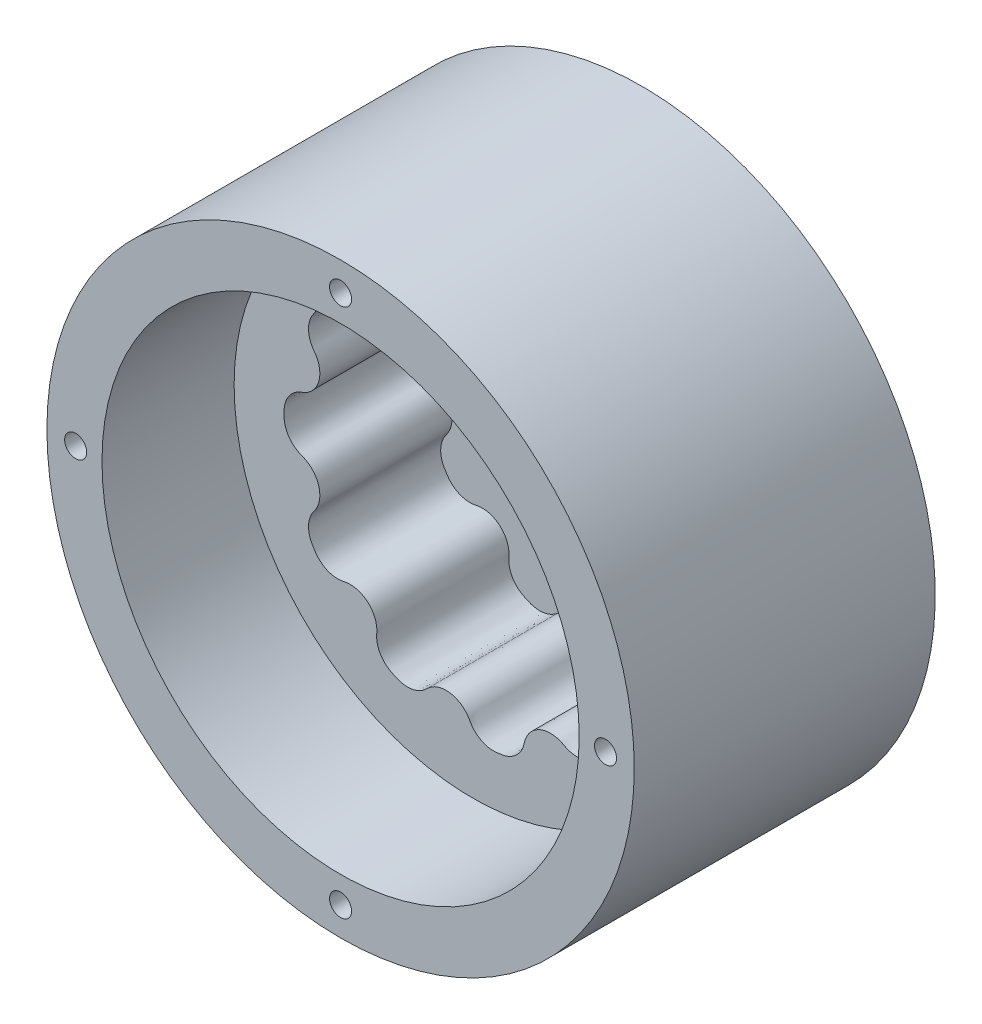
from build123d import *

# Parameters (mm, degrees)
SKETCH1_R           = 35.5
BOSS_EXTRUDE1_DEPTH = 18
BOSS_EXTRUDE4_START = 18
SKETCH2_R           = 40
SKETCH2_R_2         = 32.5
BOSS_EXTRUDE4_DEPTH = 36
SKETCH5_R           = 40
SKETCH5_R_2         = 14
BOSS_EXTRUDE5_DEPTH = 5
SKETCH6_R           = 1.5
CUT_EXTRUDE1_DEPTH  = 8


with BuildPart() as part:
    # Sketch1 → Boss-Extrude1 (new body)
    with BuildSketch(Plane.XY):
        Circle(SKETCH1_R)
        with BuildLine():
            add(Edge.make_bspline(
                [(3.837275289, 25.411912922), (3.717481283, 25.430002177), (3.597562363, 25.447243915), (3.477524524, 25.463637273), (3.43744086, 25.469111429), (3.357247678, 25.479870448), (3.236836498, 25.495587087), (3.156280382, 25.503281028), (3.115949416, 25.506455885), (1.732893374, 25.615330169), (0.492503636, 24.993935832), (-0.248417397, 23.821019107), (-0.284472247, 23.763942396), (-0.353407368, 23.647783622), (-0.446251784, 23.467496593), (-0.515240226, 23.351369479), (-0.551321274, 23.294309326), (-1.839165713, 21.257655651), (-4.2243071, 20.914724091), (-6.033776437, 22.506051276), (-6.084471653, 22.550634885), (-6.183382367, 22.642621746), (-6.323258657, 22.789448588), (-6.42212713, 22.881480847), (-6.472801872, 22.926087726), (-7.514159226, 23.842751505), (-8.87937148, 24.089516833), (-10.175730603, 23.595400807), (-10.213533421, 23.580992008), (-10.288658814, 23.550914445), (-10.399764607, 23.501910691), (-10.473678235, 23.468994458), (-10.510595982, 23.452449171), (-10.621152902, 23.402901291), (-10.731356705, 23.352572901), (-10.841201879, 23.301466516), (-10.877881956, 23.284400804), (-10.951161518, 23.25009616), (-11.060954905, 23.198218638), (-11.13288268, 23.161139269), (-11.168527706, 23.142005562), (-12.390890369, 22.48585989), (-13.098421476, 21.292504387), (-13.087597256, 19.905211894), (-13.087070525, 19.837703186), (-13.082262265, 19.702715067), (-13.062897432, 19.500852487), (-13.058151144, 19.365862174), (-13.057655406, 19.298353231), (-13.039960982, 16.888749861), (-14.861066801, 15.310752686), (-17.243625704, 15.67118932), (-17.310376952, 15.681287537), (-17.443317791, 15.705196639), (-17.640369798, 15.753092407), (-17.773299646, 15.777062538), (-17.840046252, 15.787191398), (-19.21167766, 15.99533775), (-20.493578699, 15.464840484), (-21.317006099, 14.348298976), (-21.341017869, 14.315739776), (-21.387956213, 14.249821067), (-21.454930925, 14.148528159), (-21.499315166, 14.080876537), (-21.521427293, 14.046998515), (-21.587646087, 13.945544602), (-21.653145843, 13.843624993), (-21.717923286, 13.741244781), (-21.73955411, 13.707057444), (-21.782654309, 13.638580618), (-21.846971279, 13.535579683), (-21.887434153, 13.465499442), (-21.907076194, 13.430131987), (-22.580653969, 12.217287973), (-22.530690319, 10.830853244), (-21.771557458, 9.669640549), (-21.734616381, 9.613133382), (-21.657591328, 9.502173691), (-21.532165443, 9.342825502), (-21.455191338, 9.231830461), (-21.418276207, 9.175306341), (-20.100660775, 7.157785321), (-20.779542796, 4.845725484), (-22.978745647, 3.860835483), (-23.040359878, 3.833242194), (-23.165123065, 3.781482567), (-23.356788169, 3.715240693), (-23.481575105, 3.663538348), (-23.543201998, 3.635973348), (-24.809624179, 3.069517276), (-25.601219482, 1.930186552), (-25.690282778, 0.545713601), (-25.692879932, 0.505341316), (-25.696728634, 0.424510184), (-25.698308266, 0.303087904), (-25.699071438, 0.222179806), (-25.699357502, 0.181725081), (-25.70021417, 0.060576037), (-25.70021417, -0.060576037), (-25.699357502, -0.181725081), (-25.699071438, -0.222179806), (-25.698308266, -0.303087904), (-25.696728634, -0.424510184), (-25.692879932, -0.505341316), (-25.690282778, -0.545713601), (-25.601219482, -1.930186552), (-24.809624179, -3.069517276), (-23.543201998, -3.635973348), (-23.481575105, -3.663538348), (-23.356788169, -3.715240693), (-23.165123065, -3.781482567), (-23.040359878, -3.833242194), (-22.978745647, -3.860835483), (-20.779542796, -4.845725484), (-20.100660775, -7.157785321), (-21.418276207, -9.175306341), (-21.455191338, -9.231830461), (-21.532165443, -9.342825502), (-21.657591328, -9.502173691), (-21.734616381, -9.613133382), (-21.771557458, -9.669640549), (-22.530690319, -10.830853244), (-22.580653969, -12.217287973), (-21.907076194, -13.430131987), (-21.887434153, -13.465499442), (-21.846971279, -13.535579683), (-21.782654309, -13.638580618), (-21.73955411, -13.707057444), (-21.717923286, -13.741244781), (-21.653145843, -13.843624993), (-21.587646087, -13.945544602), (-21.521427293, -14.046998515), (-21.499315166, -14.080876537), (-21.454930925, -14.148528159), (-21.387956213, -14.249821067), (-21.341017869, -14.315739776), (-21.317006099, -14.348298976), (-20.493578699, -15.464840484), (-19.21167766, -15.99533775), (-17.840046252, -15.787191398), (-17.773299646, -15.777062538), (-17.640369798, -15.753092407), (-17.443317791, -15.705196639), (-17.310376952, -15.681287537), (-17.243625704, -15.67118932), (-14.861066801, -15.310752686), (-13.039960982, -16.888749861), (-13.057655406, -19.298353231), (-13.058151144, -19.365862174), (-13.062897432, -19.500852487), (-13.082262265, -19.702715067), (-13.087070525, -19.837703186), (-13.087597256, -19.905211894), (-13.098421476, -21.292504387), (-12.390890369, -22.48585989), (-11.168527706, -23.142005562), (-11.13288268, -23.161139269), (-11.060954905, -23.198218638), (-10.951161518, -23.25009616), (-10.877881956, -23.284400804), (-10.841201879, -23.301466516), (-10.731356705, -23.352572901), (-10.621152902, -23.402901291), (-10.510595982, -23.452449171), (-10.473678235, -23.468994458), (-10.399764607, -23.501910691), (-10.288658814, -23.550914445), (-10.213533421, -23.580992008), (-10.175730603, -23.595400807), (-8.87937148, -24.089516833), (-7.514159226, -23.842751505), (-6.472801872, -22.926087726), (-6.42212713, -22.881480847), (-6.323258657, -22.789448588), (-6.183382367, -22.642621746), (-6.084471653, -22.550634885), (-6.033776437, -22.506051276), (-4.2243071, -20.914724091), (-1.839165713, -21.257655651), (-0.551321274, -23.294309326), (-0.515240226, -23.351369479), (-0.446251784, -23.467496593), (-0.353407368, -23.647783622), (-0.284472247, -23.763942396), (-0.248417397, -23.821019107), (0.492503636, -24.993935832), (1.732893374, -25.615330169), (3.115949416, -25.506455885), (3.156280382, -25.503281028), (3.236836498, -25.495587087), (3.357247678, -25.479870448), (3.43744086, -25.469111429), (3.477524524, -25.463637273), (3.597562363, -25.447243915), (3.717481283, -25.430002177), (3.837275289, -25.411912922), (3.877277532, -25.405872463), (3.957253491, -25.393602636), (4.077215062, -25.37475889), (4.156675722, -25.359445892), (4.196267462, -25.351129599), (5.553973446, -25.065941795), (6.569051669, -24.120260123), (6.949511367, -22.786113189), (6.968025374, -22.721190661), (7.00144243, -22.590315865), (7.039733269, -22.391174434), (7.073210405, -22.260314993), (7.091754215, -22.195400971), (7.753640258, -19.878418374), (9.945551675, -18.87740597), (12.130053466, -19.8944868), (12.191255824, -19.922981967), (12.312075652, -19.983376345), (12.487651871, -20.084847964), (12.60844396, -20.145297802), (12.669633229, -20.173821064), (13.927062324, -20.75996925), (15.306495715, -20.612114109), (16.411134614, -19.772786684), (16.443346725, -19.748311257), (16.506955183, -19.698286778), (16.599754458, -19.619965902), (16.66140049, -19.567559132), (16.692161462, -19.541283113), (16.7842808, -19.462594787), (16.875841428, -19.383257052), (16.966838768, -19.303273873), (16.997225078, -19.27656547), (17.057871567, -19.223005167), (17.148601964, -19.142296677), (17.207169693, -19.086454887), (17.235980257, -19.058053866), (18.223971045, -18.084107345), (18.566635074, -16.739756577), (18.16540385, -15.411708713), (18.145879055, -15.347082979), (18.103235015, -15.21891747), (18.027783333, -15.030687447), (17.985198137, -14.902502374), (17.965703012, -14.837867684), (17.269861618, -12.530855277), (18.572626677, -10.503713276), (20.960221938, -10.178305282), (21.027114288, -10.16918845), (21.161406062, -10.154675303), (21.363969875, -10.14511499), (21.498268297, -10.130663497), (21.565164825, -10.121577375), (22.939877128, -9.934859113), (24.020393817, -9.064697457), (24.495900528, -7.761397418), (24.509766665, -7.723392198), (24.53623223, -7.646919599), (24.571956485, -7.530860809), (24.595483189, -7.453445068), (24.607155077, -7.414709637), (24.642108675, -7.298709331), (24.676241158, -7.182464768), (24.709550821, -7.065981759), (24.720673758, -7.027085142), (24.742735946, -6.94923938), (24.775428909, -6.832290522), (24.794508867, -6.753649314), (24.803391104, -6.714180688), (25.107986602, -5.360696589), (24.669443029, -4.044498595), (23.613908961, -3.144195615), (23.562544349, -3.100384889), (23.457378394, -3.015620311), (23.292139566, -2.898063398), (23.187012537, -2.813250548), (23.135668043, -2.769416246), (21.303023938, -1.204834168), (21.303023938, 1.204834168), (23.135668043, 2.769416246), (23.187012537, 2.813250548), (23.292139566, 2.898063398), (23.457378394, 3.015620311), (23.562544349, 3.100384889), (23.613908961, 3.144195615), (24.669443029, 4.044498595), (25.107986602, 5.360696589), (24.803391104, 6.714180688), (24.794508867, 6.753649314), (24.775428909, 6.832290522), (24.742735946, 6.94923938), (24.720673758, 7.027085142), (24.709550821, 7.065981759), (24.676241158, 7.182464768), (24.642108675, 7.298709331), (24.607155077, 7.414709637), (24.595483189, 7.453445068), (24.571956485, 7.530860809), (24.53623223, 7.646919599), (24.509766665, 7.723392198), (24.495900528, 7.761397418), (24.020393817, 9.064697457), (22.939877128, 9.934859113), (21.565164825, 10.121577375), (21.498268297, 10.130663497), (21.363969875, 10.14511499), (21.161406062, 10.154675303), (21.027114288, 10.16918845), (20.960221938, 10.178305282), (18.572626677, 10.503713276), (17.269861618, 12.530855277), (17.965703012, 14.837867684), (17.985198137, 14.902502374), (18.027783333, 15.030687447), (18.103235015, 15.21891747), (18.145879055, 15.347082979), (18.16540385, 15.411708713), (18.566635074, 16.739756577), (18.223971045, 18.084107345), (17.235980257, 19.058053866), (17.207169693, 19.086454887), (17.148601964, 19.142296677), (17.057871567, 19.223005167), (16.997225078, 19.27656547), (16.966838768, 19.303273873), (16.875841428, 19.383257052), (16.7842808, 19.462594787), (16.692161462, 19.541283113), (16.66140049, 19.567559132), (16.599754458, 19.619965902), (16.506955183, 19.698286778), (16.443346725, 19.748311257), (16.411134614, 19.772786684), (15.306495715, 20.612114109), (13.927062324, 20.75996925), (12.669633229, 20.173821064), (12.60844396, 20.145297802), (12.487651871, 20.084847964), (12.312075652, 19.983376345), (12.191255824, 19.922981967), (12.130053466, 19.8944868), (9.945551675, 18.87740597), (7.753640258, 19.878418374), (7.091754215, 22.195400971), (7.073210405, 22.260314993), (7.039733269, 22.391174434), (7.00144243, 22.590315865), (6.968025374, 22.721190661), (6.949511367, 22.786113189), (6.569051669, 24.120260123), (5.553973446, 25.065941795), (4.196267462, 25.351129599), (4.156675722, 25.359445892), (4.077215062, 25.37475889), (3.957253491, 25.393602636), (3.877277532, 25.405872463), (3.837275289, 25.411912922)],
                knots=[0, 0, 0, 0, 0.002149486, 0.002149486, 0.002149486, 0.002867266, 0.003585046, 0.004302825, 0.004302825, 0.004302825, 0.026557243, 0.026557243, 0.026557243, 0.027755042, 0.028952842, 0.030150641, 0.030150641, 0.030150641, 0.062907936, 0.062907936, 0.062907936, 0.064105736, 0.065303535, 0.066501334, 0.066501334, 0.066501334, 0.088755752, 0.088755752, 0.088755752, 0.089473532, 0.090191311, 0.090909091, 0.090909091, 0.090909091, 0.093058577, 0.093058577, 0.093058577, 0.093776357, 0.094494137, 0.095211916, 0.095211916, 0.095211916, 0.117466334, 0.117466334, 0.117466334, 0.118664133, 0.119861933, 0.121059732, 0.121059732, 0.121059732, 0.153817027, 0.153817027, 0.153817027, 0.155014826, 0.156212626, 0.157410425, 0.157410425, 0.157410425, 0.179664843, 0.179664843, 0.179664843, 0.180382622, 0.181100402, 0.181818182, 0.181818182, 0.181818182, 0.183967668, 0.183967668, 0.183967668, 0.184685448, 0.185403227, 0.186121007, 0.186121007, 0.186121007, 0.208375425, 0.208375425, 0.208375425, 0.209573224, 0.210771023, 0.211968823, 0.211968823, 0.211968823, 0.244726118, 0.244726118, 0.244726118, 0.245923917, 0.247121717, 0.248319516, 0.248319516, 0.248319516, 0.270573934, 0.270573934, 0.270573934, 0.271291713, 0.272009493, 0.272727273, 0.272727273, 0.272727273, 0.274876759, 0.274876759, 0.274876759, 0.275594539, 0.276312318, 0.277030098, 0.277030098, 0.277030098, 0.299284516, 0.299284516, 0.299284516, 0.300482315, 0.301680114, 0.302877914, 0.302877914, 0.302877914, 0.335635209, 0.335635209, 0.335635209, 0.336833008, 0.338030808, 0.339228607, 0.339228607, 0.339228607, 0.361483025, 0.361483025, 0.361483025, 0.362200804, 0.362918584, 0.363636364, 0.363636364, 0.363636364, 0.36578585, 0.36578585, 0.36578585, 0.36650363, 0.367221409, 0.367939189, 0.367939189, 0.367939189, 0.390193607, 0.390193607, 0.390193607, 0.391391406, 0.392589205, 0.393787005, 0.393787005, 0.393787005, 0.4265443, 0.4265443, 0.4265443, 0.427742099, 0.428939899, 0.430137698, 0.430137698, 0.430137698, 0.452392115, 0.452392115, 0.452392115, 0.453109895, 0.453827675, 0.454545455, 0.454545455, 0.454545455, 0.456694941, 0.456694941, 0.456694941, 0.45741272, 0.4581305, 0.45884828, 0.45884828, 0.45884828, 0.481102697, 0.481102697, 0.481102697, 0.482300497, 0.483498296, 0.484696096, 0.484696096, 0.484696096, 0.517453391, 0.517453391, 0.517453391, 0.51865119, 0.519848989, 0.521046789, 0.521046789, 0.521046789, 0.543301206, 0.543301206, 0.543301206, 0.544018986, 0.544736766, 0.545454545, 0.545454545, 0.545454545, 0.547604032, 0.547604032, 0.547604032, 0.548321811, 0.549039591, 0.549757371, 0.549757371, 0.549757371, 0.572011788, 0.572011788, 0.572011788, 0.573209588, 0.574407387, 0.575605186, 0.575605186, 0.575605186, 0.608362482, 0.608362482, 0.608362482, 0.609560281, 0.61075808, 0.61195588, 0.61195588, 0.61195588, 0.634210297, 0.634210297, 0.634210297, 0.634928077, 0.635645857, 0.636363636, 0.636363636, 0.636363636, 0.638513123, 0.638513123, 0.638513123, 0.639230902, 0.639948682, 0.640666462, 0.640666462, 0.640666462, 0.662920879, 0.662920879, 0.662920879, 0.664118679, 0.665316478, 0.666514277, 0.666514277, 0.666514277, 0.699271573, 0.699271573, 0.699271573, 0.700469372, 0.701667171, 0.702864971, 0.702864971, 0.702864971, 0.725119388, 0.725119388, 0.725119388, 0.725837168, 0.726554948, 0.727272727, 0.727272727, 0.727272727, 0.729422214, 0.729422214, 0.729422214, 0.730139993, 0.730857773, 0.731575553, 0.731575553, 0.731575553, 0.75382997, 0.75382997, 0.75382997, 0.75502777, 0.756225569, 0.757423368, 0.757423368, 0.757423368, 0.790180663, 0.790180663, 0.790180663, 0.791378463, 0.792576262, 0.793774061, 0.793774061, 0.793774061, 0.816028479, 0.816028479, 0.816028479, 0.816746259, 0.817464038, 0.818181818, 0.818181818, 0.818181818, 0.820331304, 0.820331304, 0.820331304, 0.821049084, 0.821766864, 0.822484643, 0.822484643, 0.822484643, 0.844739061, 0.844739061, 0.844739061, 0.84593686, 0.84713466, 0.848332459, 0.848332459, 0.848332459, 0.881089754, 0.881089754, 0.881089754, 0.882287554, 0.883485353, 0.884683152, 0.884683152, 0.884683152, 0.90693757, 0.90693757, 0.90693757, 0.90765535, 0.908373129, 0.909090909, 0.909090909, 0.909090909, 0.911240395, 0.911240395, 0.911240395, 0.911958175, 0.912675955, 0.913393734, 0.913393734, 0.913393734, 0.935648152, 0.935648152, 0.935648152, 0.936845951, 0.938043751, 0.93924155, 0.93924155, 0.93924155, 0.971998845, 0.971998845, 0.971998845, 0.973196645, 0.974394444, 0.975592243, 0.975592243, 0.975592243, 0.997846661, 0.997846661, 0.997846661, 0.998564441, 0.99928222, 1, 1, 1, 1], degree=3, weights=[1, 0.999983333, 0.999983333, 1, 1, 1, 1, 1, 1, 0.904115513, 0.904115513, 1, 1, 1, 1, 1, 1, 0.766195691, 0.766195691, 1, 1, 1, 1, 1, 1, 0.904115513, 0.904115513, 1, 1, 1, 1, 1, 1, 0.999983333, 0.999983333, 1, 1, 1, 1, 1, 1, 0.904115513, 0.904115513, 1, 1, 1, 1, 1, 1, 0.766195691, 0.766195691, 1, 1, 1, 1, 1, 1, 0.904115513, 0.904115513, 1, 1, 1, 1, 1, 1, 0.999983333, 0.999983333, 1, 1, 1, 1, 1, 1, 0.904115513, 0.904115513, 1, 1, 1, 1, 1, 1, 0.766195691, 0.766195691, 1, 1, 1, 1, 1, 1, 0.904115513, 0.904115513, 1, 1, 1, 1, 1, 1, 0.999983333, 0.999983333, 1, 1, 1, 1, 1, 1, 0.904115513, 0.904115513, 1, 1, 1, 1, 1, 1, 0.766195691, 0.766195691, 1, 1, 1, 1, 1, 1, 0.904115513, 0.904115513, 1, 1, 1, 1, 1, 1, 0.999983333, 0.999983333, 1, 1, 1, 1, 1, 1, 0.904115513, 0.904115513, 1, 1, 1, 1, 1, 1, 0.766195691, 0.766195691, 1, 1, 1, 1, 1, 1, 0.904115513, 0.904115513, 1, 1, 1, 1, 1, 1, 0.999983333, 0.999983333, 1, 1, 1, 1, 1, 1, 0.904115513, 0.904115513, 1, 1, 1, 1, 1, 1, 0.766195691, 0.766195691, 1, 1, 1, 1, 1, 1, 0.904115513, 0.904115513, 1, 1, 1, 1, 1, 1, 0.999983333, 0.999983333, 1, 1, 1, 1, 1, 1, 0.904115513, 0.904115513, 1, 1, 1, 1, 1, 1, 0.766195691, 0.766195691, 1, 1, 1, 1, 1, 1, 0.904115513, 0.904115513, 1, 1, 1, 1, 1, 1, 0.999983333, 0.999983333, 1, 1, 1, 1, 1, 1, 0.904115513, 0.904115513, 1, 1, 1, 1, 1, 1, 0.766195691, 0.766195691, 1, 1, 1, 1, 1, 1, 0.904115513, 0.904115513, 1, 1, 1, 1, 1, 1, 0.999983333, 0.999983333, 1, 1, 1, 1, 1, 1, 0.904115513, 0.904115513, 1, 1, 1, 1, 1, 1, 0.766195691, 0.766195691, 1, 1, 1, 1, 1, 1, 0.904115513, 0.904115513, 1, 1, 1, 1, 1, 1, 0.999983333, 0.999983333, 1, 1, 1, 1, 1, 1, 0.904115513, 0.904115513, 1, 1, 1, 1, 1, 1, 0.766195691, 0.766195691, 1, 1, 1, 1, 1, 1, 0.904115513, 0.904115513, 1, 1, 1, 1, 1, 1, 0.999983333, 0.999983333, 1, 1, 1, 1, 1, 1, 0.904115513, 0.904115513, 1, 1, 1, 1, 1, 1, 0.766195691, 0.766195691, 1, 1, 1, 1, 1, 1, 0.904115513, 0.904115513, 1, 1, 1, 1, 1, 1]))
        make_face(mode=Mode.SUBTRACT)
    extrude(amount=BOSS_EXTRUDE1_DEPTH)

    # Sketch2 → Boss-Extrude4 (add)
    with BuildSketch(Plane.XY.offset(18).offset(BOSS_EXTRUDE4_START)):
        Circle(SKETCH2_R)
        Circle(SKETCH2_R_2, mode=Mode.SUBTRACT)
    extrude(amount=-BOSS_EXTRUDE4_DEPTH)

    # Sketch5 → Boss-Extrude5 (add)
    with BuildSketch(Plane(origin=(0, 0, 0), x_dir=(-1, 0, 0), z_dir=(0, 0, -1))):
        Circle(SKETCH5_R)
        Circle(SKETCH5_R_2, mode=Mode.SUBTRACT)
    extrude(amount=BOSS_EXTRUDE5_DEPTH)

    # Sketch6 → Cut-Extrude1 (cut)
    with BuildSketch(Plane.XY.offset(36)):
        with Locations((0, 36.085380588)):
            Circle(SKETCH6_R)
        with Locations((36.085380588, 0)):
            Circle(SKETCH6_R)
        with Locations((0, -36.085380588)):
            Circle(SKETCH6_R)
        with Locations((-36.085380588, 0)):
            Circle(SKETCH6_R)
    extrude(amount=-CUT_EXTRUDE1_DEPTH, mode=Mode.SUBTRACT)


solid = part.part
